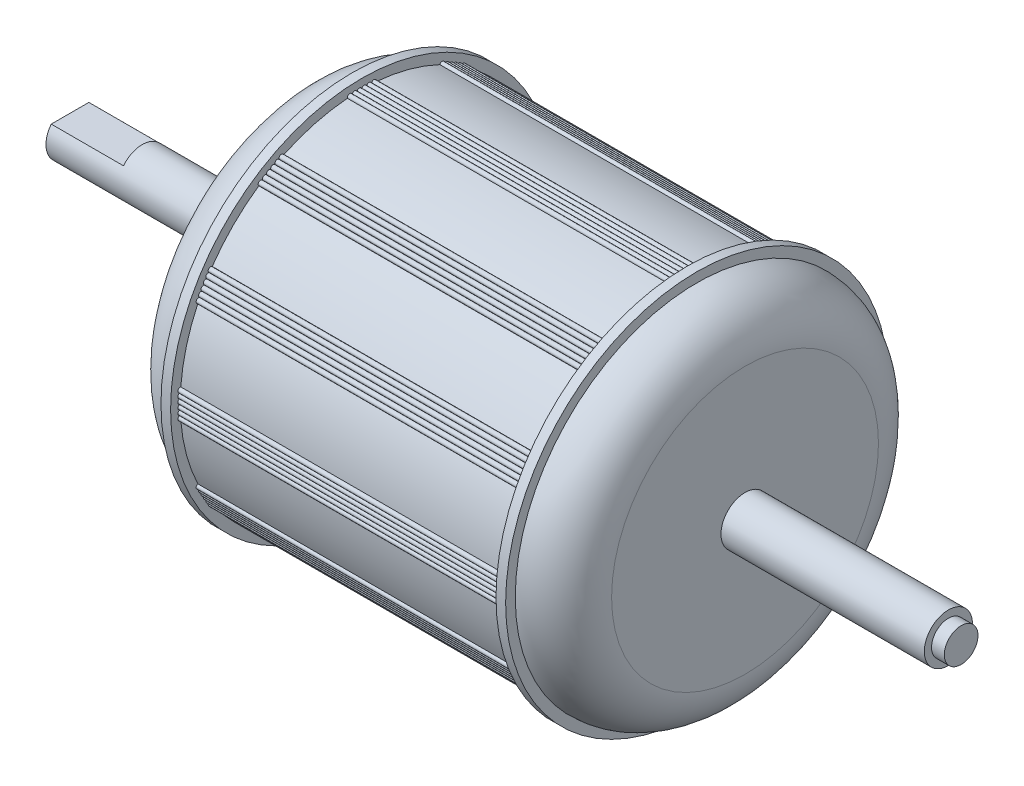
from build123d import *

# Parameters (mm, degrees)
CUT_EXTRUDE1_DEPTH   = 15
CUT_EXTRUDE2_DEPTH   = 67.56
BOSS_EXTRUDE10_REACH = 138.513
SKETCH4_R            = 0.5
LPATTERN3_COUNT      = 6
LPATTERN3_PITCH      = 1
CIRPATTERN1_COUNT    = 12
CIRPATTERN1_2_COUNT  = 12
CIRPATTERN1_3_COUNT  = 12
CIRPATTERN1_4_COUNT  = 12
CIRPATTERN1_5_COUNT  = 12
CIRPATTERN1_6_COUNT  = 12


with BuildPart() as part:
    # Sketch1 → Revolve1 (revolve)
    with BuildSketch(Plane.XY, mode=Mode.PRIVATE) as revolve1_sk:
        with BuildLine():
            Line((185.01, 0), (185.01, 3.5))
            Line((185.01, 3.5), (182.36, 3.5))
            Line((182.36, 3.5), (182.36, 5))
            Line((182.36, 5), (140.14, 5))
            Line((140.14, 5), (140.14, 27.705))
            ThreePointArc((140.14, 27.705), (137.211067812, 34.776067812), (130.14, 37.705))
            Line((130.14, 37.705), (130.14, 39.705))
            Line((130.14, 39.705), (128.14, 39.705))
            Line((128.14, 39.705), (128.14, 37.71))
            Line((128.14, 37.71), (60.58, 37.71))
            Line((60.58, 37.71), (60.58, 39.705))
            Line((60.58, 39.705), (58.58, 39.705))
            Line((58.58, 39.705), (58.58, 37.705))
            ThreePointArc((58.58, 37.705), (51.508932188, 34.776067812), (48.58, 27.705))
            Line((48.58, 27.705), (48.58, 5))
            Line((48.58, 5), (0, 5))
            Line((0, 5), (0, 0))
            Line((0, 0), (185.01, 0))
        make_face()
    revolve(revolve1_sk.sketch.rotate(Axis((185.01, 0, 0), (-1, 0, 0)), 90), axis=Axis((185.01, 0, 0), (-1, 0, 0)))

    # Sketch2 → Cut-Extrude1 (cut)
    with BuildSketch(Plane.ZY):
        with BuildLine():
            Line((-3.905, 3.12265512), (-3.905, 3.12))
            Line((-3.905, 3.12), (3.905, 3.12))
            Line((3.905, 3.12), (3.905, 3.12265512))
            ThreePointArc((3.905, 3.12265512), (0, 5), (-3.905, 3.12265512))
        make_face()
    extrude(amount=-CUT_EXTRUDE1_DEPTH, mode=Mode.SUBTRACT)

    # Sketch3 → Cut-Extrude2 (cut)
    with BuildSketch(Plane(origin=(60.58, 0, 0), x_dir=(0, 0, -1), z_dir=(1, 0, 0))):
        with BuildLine():
            Line((-3, 37.590478848), (-3, 34.71))
            ThreePointArc((-3, 34.71), (0, 31.71), (3, 34.71))
            Line((3, 34.71), (3, 37.590478848))
            ThreePointArc((3, 37.590478848), (0, 37.71), (-3, 37.590478848))
        make_face()
        with BuildLine():
            Line((16.197163213, 34.054309623), (14.756923789, 31.559741765))
            ThreePointArc((14.756923789, 31.559741765), (15.855, 27.461665554), (19.953076211, 28.559741765))
            Line((19.953076211, 28.559741765), (21.393315635, 31.054309623))
            ThreePointArc((21.393315635, 31.054309623), (18.855, 32.657817977), (16.197163213, 34.054309623))
        make_face()
        with BuildLine():
            Line((31.054309623, 21.393315635), (28.559741765, 19.953076211))
            ThreePointArc((28.559741765, 19.953076211), (27.461665554, 15.855), (31.559741765, 14.756923789))
            Line((31.559741765, 14.756923789), (34.054309623, 16.197163213))
            ThreePointArc((34.054309623, 16.197163213), (32.657817977, 18.855), (31.054309623, 21.393315635))
        make_face()
        with BuildLine():
            Line((37.590478848, 3), (34.71, 3))
            ThreePointArc((34.71, 3), (31.71, 0), (34.71, -3))
            Line((34.71, -3), (37.590478848, -3))
            ThreePointArc((37.590478848, -3), (37.71, 0), (37.590478848, 3))
        make_face()
        with BuildLine():
            Line((34.054309623, -16.197163213), (31.559741765, -14.756923789))
            ThreePointArc((31.559741765, -14.756923789), (27.461665554, -15.855), (28.559741765, -19.953076211))
            Line((28.559741765, -19.953076211), (31.054309623, -21.393315635))
            ThreePointArc((31.054309623, -21.393315635), (32.657817977, -18.855), (34.054309623, -16.197163213))
        make_face()
        with BuildLine():
            Line((21.393315635, -31.054309623), (19.953076211, -28.559741765))
            ThreePointArc((19.953076211, -28.559741765), (15.855, -27.461665554), (14.756923789, -31.559741765))
            Line((14.756923789, -31.559741765), (16.197163213, -34.054309623))
            ThreePointArc((16.197163213, -34.054309623), (18.855, -32.657817977), (21.393315635, -31.054309623))
        make_face()
        with BuildLine():
            Line((3, -37.590478848), (3, -34.71))
            ThreePointArc((3, -34.71), (0, -31.71), (-3, -34.71))
            Line((-3, -34.71), (-3, -37.590478848))
            ThreePointArc((-3, -37.590478848), (0, -37.71), (3, -37.590478848))
        make_face()
        with BuildLine():
            Line((-16.197163213, -34.054309623), (-14.756923789, -31.559741765))
            ThreePointArc((-14.756923789, -31.559741765), (-15.855, -27.461665554), (-19.953076211, -28.559741765))
            Line((-19.953076211, -28.559741765), (-21.393315635, -31.054309623))
            ThreePointArc((-21.393315635, -31.054309623), (-18.855, -32.657817977), (-16.197163213, -34.054309623))
        make_face()
        with BuildLine():
            Line((-31.054309623, -21.393315635), (-28.559741765, -19.953076211))
            ThreePointArc((-28.559741765, -19.953076211), (-27.461665554, -15.855), (-31.559741765, -14.756923789))
            Line((-31.559741765, -14.756923789), (-34.054309623, -16.197163213))
            ThreePointArc((-34.054309623, -16.197163213), (-32.657817977, -18.855), (-31.054309623, -21.393315635))
        make_face()
        with BuildLine():
            Line((-37.590478848, -3), (-34.71, -3))
            ThreePointArc((-34.71, -3), (-31.71, 0), (-34.71, 3))
            Line((-34.71, 3), (-37.590478848, 3))
            ThreePointArc((-37.590478848, 3), (-37.71, 0), (-37.590478848, -3))
        make_face()
        with BuildLine():
            Line((-34.054309623, 16.197163213), (-31.559741765, 14.756923789))
            ThreePointArc((-31.559741765, 14.756923789), (-27.461665554, 15.855), (-28.559741765, 19.953076211))
            Line((-28.559741765, 19.953076211), (-31.054309623, 21.393315635))
            ThreePointArc((-31.054309623, 21.393315635), (-32.657817977, 18.855), (-34.054309623, 16.197163213))
        make_face()
        with BuildLine():
            Line((-21.393315635, 31.054309623), (-19.953076211, 28.559741765))
            ThreePointArc((-19.953076211, 28.559741765), (-15.855, 27.461665554), (-14.756923789, 31.559741765))
            Line((-14.756923789, 31.559741765), (-16.197163213, 34.054309623))
            ThreePointArc((-16.197163213, 34.054309623), (-18.855, 32.657817977), (-21.393315635, 31.054309623))
        make_face()
    extrude(amount=CUT_EXTRUDE2_DEPTH, mode=Mode.SUBTRACT)


with BuildPart() as body_2:

    # Sketch4 → Boss-Extrude10 (new, up to next)
    with BuildSketch(Plane(origin=(60.58, 0, 0), x_dir=(0, 0, -1), z_dir=(1, 0, 0)), mode=Mode.PRIVATE) as boss_extrude10_sk1:
        with Locations(Location((-2.5, 37.7, 0), (0, 0, 180))):
            Circle(SKETCH4_R)
    boss_extrude10_tool1 = extrude(boss_extrude10_sk1.sketch, amount=BOSS_EXTRUDE10_REACH, mode=Mode.PRIVATE) - part.part
    add(boss_extrude10_tool1.solids().sort_by_distance((60.58, 37.7, 2.5))[0])


with BuildPart() as lpattern3_1:
    # LPattern3: pattern copy
    add(body_2.part.moved(Location(Vector(0, 0, -1) * (1 * LPATTERN3_PITCH))))

    # CirPattern1 5: LPattern3_1 ×12 about axis
    cirpattern1_5_axis = Axis((0, 0, 0), (1, 0, 0))


with BuildPart() as lpattern3_2:
    # LPattern3: pattern copy
    add(body_2.part.moved(Location(Vector(0, 0, -1) * (2 * LPATTERN3_PITCH))))

    # CirPattern1 4: LPattern3_2 ×12 about axis
    cirpattern1_4_axis = Axis((0, 0, 0), (1, 0, 0))


with BuildPart() as lpattern3_3:
    # LPattern3: pattern copy
    add(body_2.part.moved(Location(Vector(0, 0, -1) * (3 * LPATTERN3_PITCH))))

    # CirPattern1 3: LPattern3_3 ×12 about axis
    cirpattern1_3_axis = Axis((0, 0, 0), (1, 0, 0))


with BuildPart() as lpattern3_4:
    # LPattern3: pattern copy
    add(body_2.part.moved(Location(Vector(0, 0, -1) * (4 * LPATTERN3_PITCH))))

    # CirPattern1 2: LPattern3_4 ×12 about axis
    cirpattern1_2_axis = Axis((0, 0, 0), (1, 0, 0))


with BuildPart() as lpattern3_5:
    # LPattern3: pattern copy
    add(body_2.part.moved(Location(Vector(0, 0, -1) * (5 * LPATTERN3_PITCH))))

    # CirPattern1: LPattern3_5 ×12 about axis
    cirpattern1_axis = Axis((0, 0, 0), (1, 0, 0))


with BuildPart() as lpattern3_5_1:
    add(lpattern3_5.part)
    for i in range(1, CIRPATTERN1_COUNT):
        add(lpattern3_5.part.rotate(cirpattern1_axis, i * 360 / CIRPATTERN1_COUNT))


with BuildPart() as lpattern3_4_1:
    add(lpattern3_4.part)
    for i in range(1, CIRPATTERN1_2_COUNT):
        add(lpattern3_4.part.rotate(cirpattern1_2_axis, i * 360 / CIRPATTERN1_2_COUNT))


with BuildPart() as lpattern3_3_1:
    add(lpattern3_3.part)
    for i in range(1, CIRPATTERN1_3_COUNT):
        add(lpattern3_3.part.rotate(cirpattern1_3_axis, i * 360 / CIRPATTERN1_3_COUNT))


with BuildPart() as lpattern3_2_1:
    add(lpattern3_2.part)
    for i in range(1, CIRPATTERN1_4_COUNT):
        add(lpattern3_2.part.rotate(cirpattern1_4_axis, i * 360 / CIRPATTERN1_4_COUNT))


with BuildPart() as lpattern3_1_1:
    add(lpattern3_1.part)
    for i in range(1, CIRPATTERN1_5_COUNT):
        add(lpattern3_1.part.rotate(cirpattern1_5_axis, i * 360 / CIRPATTERN1_5_COUNT))


with BuildPart() as body_2_1:
    add(body_2.part)

    # CirPattern1 6: body 2 ×12 about axis
    cirpattern1_6_axis = Axis((0, 0, 0), (1, 0, 0))


with BuildPart() as body_2_2:
    add(body_2_1.part)
    for i in range(1, CIRPATTERN1_6_COUNT):
        add(body_2_1.part.rotate(cirpattern1_6_axis, i * 360 / CIRPATTERN1_6_COUNT))


solid = Compound([part.part, lpattern3_5_1.part, lpattern3_4_1.part, lpattern3_3_1.part, lpattern3_2_1.part, lpattern3_1_1.part, body_2_2.part])
